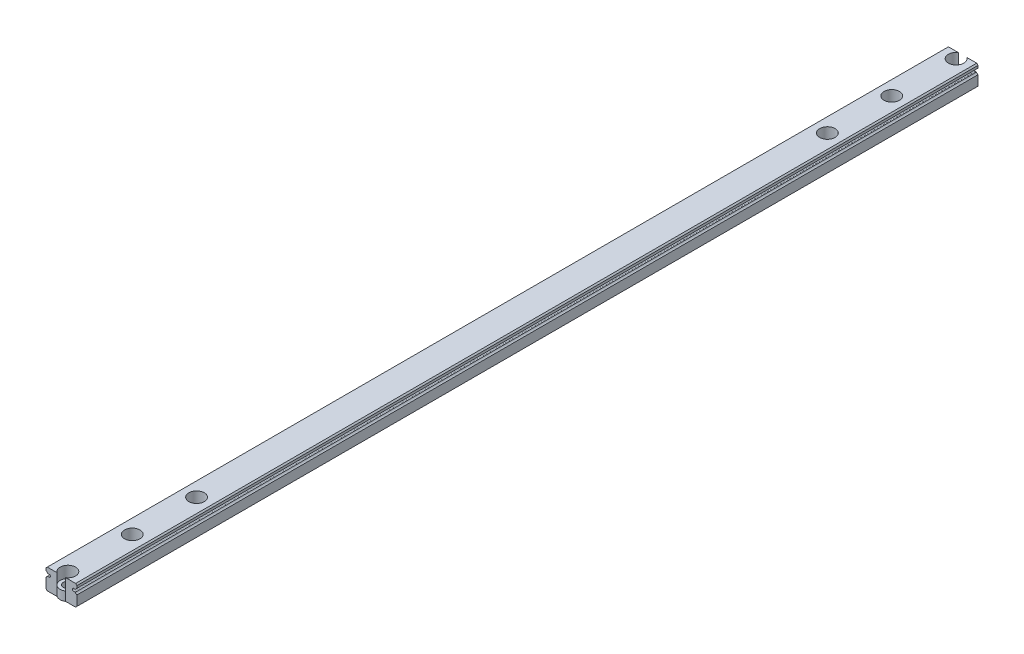
from build123d import *

# Parameters (mm, degrees)
BOSS_EXTRUDE1_DEPTH     = 420
SKETCH2_R               = 3
CUT_EXTRUDE1_DEPTH      = 4.5
SKETCH3_R               = 1.75
CUT_EXTRUDE2_DEPTH      = 421.066958948
LPATTERN1_COUNT         = 4
LPATTERN1_PITCH         = 25
MIRROR1_COPY_1_SKETCH_R = 3
MIRROR1_COPY_1_DEPTH    = 4.5
MIRROR1_COPY_2_SKETCH_R = 3
MIRROR1_COPY_2_DEPTH    = 4.5
MIRROR1_COPY_3_SKETCH_R = 3
MIRROR1_COPY_3_DEPTH    = 4.5
MIRROR1_COPY_4_SKETCH_R = 1.75
MIRROR1_COPY_4_DEPTH    = 421.066958948
MIRROR1_COPY_5_SKETCH_R = 1.75
MIRROR1_COPY_5_DEPTH    = 421.066958948
MIRROR1_COPY_6_SKETCH_R = 1.75
MIRROR1_COPY_6_DEPTH    = 421.066958948
SKETCH5_R               = 3
SKETCH5_W               = 0.5
SKETCH5_H               = 35
CUT_EXTRUDE3_DEPTH      = 421.119030752


with BuildPart() as part:
    # Sketch1 → Boss-Extrude1 (new body)
    with BuildSketch(Plane.XY):
        with BuildLine():
            Line((6, -3.5), (6, 0.368911094))
            ThreePointArc((6, 0.368911094), (5.63354293, 0.61854293), (5.383911094, 0.985))
            Line((5.383911094, 0.985), (4.92112495, 0.985))
            ThreePointArc((4.92112495, 0.985), (4.265, 1.46), (4.92112495, 1.935))
            Line((4.92112495, 1.935), (5.383911094, 1.935))
            ThreePointArc((5.383911094, 1.935), (5.63354293, 2.30145707), (6, 2.551088906))
            Line((6, 2.551088906), (6, 3.5))
            Line((6, 3.5), (5.5, 4))
            Line((5.5, 4), (-5.5, 4))
            Line((-5.5, 4), (-6, 3.5))
            Line((-6, 3.5), (-6, 2.551088906))
            ThreePointArc((-6, 2.551088906), (-5.63354293, 2.30145707), (-5.383911094, 1.935))
            Line((-5.383911094, 1.935), (-4.92112495, 1.935))
            ThreePointArc((-4.92112495, 1.935), (-4.265, 1.46), (-4.92112495, 0.985))
            Line((-4.92112495, 0.985), (-5.383911094, 0.985))
            ThreePointArc((-5.383911094, 0.985), (-5.63354293, 0.61854293), (-6, 0.368911094))
            Line((-6, 0.368911094), (-6, -3.5))
            Line((-6, -3.5), (-5.5, -4))
            Line((-5.5, -4), (5.5, -4))
            Line((5.5, -4), (6, -3.5))
        make_face()
    extrude(amount=BOSS_EXTRUDE1_DEPTH)

    # Sketch2 → Cut-Extrude1 (cut)
    with BuildSketch(Plane(origin=(0, 4, 0), x_dir=(1, 0, 0), z_dir=(0, 1, 0))):
        with Locations(Location((0, -12.5, 0), (0, 0, 180))):
            Circle(SKETCH2_R)
    cut_extrude1 = extrude(amount=-CUT_EXTRUDE1_DEPTH, mode=Mode.SUBTRACT)

    # Sketch3 → Cut-Extrude2 (cut, through all)
    with BuildSketch(Plane(origin=(0, -0.5, 0), x_dir=(1, 0, 0), z_dir=(0, 1, 0))):
        with Locations(Location((0, -12.5, 0), (0, 0, 180))):
            Circle(SKETCH3_R)
    cut_extrude2 = extrude(amount=-CUT_EXTRUDE2_DEPTH, mode=Mode.SUBTRACT)

    # LPattern1: Cut-Extrude1, Cut-Extrude2 ×4
    with Locations(*[(0, 0, i * LPATTERN1_PITCH) for i in range(1, LPATTERN1_COUNT)]):
        add(cut_extrude1, mode=Mode.SUBTRACT)
        add(cut_extrude2, mode=Mode.SUBTRACT)

    # Mirror1: Cut-Extrude1, Cut-Extrude2 across plane
    add(cut_extrude1.mirror(Plane.XY.offset(210)), mode=Mode.SUBTRACT)
    add(cut_extrude2.mirror(Plane.XY.offset(210)), mode=Mode.SUBTRACT)

    # Mirror1 copy 1 sketch → Mirror1 copy 1 (cut)
    with BuildSketch(Plane(origin=(0, 4, 395), x_dir=(1, 0, 0), z_dir=(0, 1, 0))):
        with Locations((0, 12.5)):
            Circle(MIRROR1_COPY_1_SKETCH_R)
    extrude(amount=-MIRROR1_COPY_1_DEPTH, mode=Mode.SUBTRACT)

    # Mirror1 copy 2 sketch → Mirror1 copy 2 (cut)
    with BuildSketch(Plane(origin=(0, 4, 370), x_dir=(1, 0, 0), z_dir=(0, 1, 0))):
        with Locations((0, 12.5)):
            Circle(MIRROR1_COPY_2_SKETCH_R)
    extrude(amount=-MIRROR1_COPY_2_DEPTH, mode=Mode.SUBTRACT)

    # Mirror1 copy 3 sketch → Mirror1 copy 3 (cut)
    with BuildSketch(Plane(origin=(0, 4, 345), x_dir=(1, 0, 0), z_dir=(0, 1, 0))):
        with Locations((0, 12.5)):
            Circle(MIRROR1_COPY_3_SKETCH_R)
    extrude(amount=-MIRROR1_COPY_3_DEPTH, mode=Mode.SUBTRACT)

    # Mirror1 copy 4 sketch → Mirror1 copy 4 (cut, through all)
    with BuildSketch(Plane(origin=(0, -0.5, 395), x_dir=(1, 0, 0), z_dir=(0, 1, 0))):
        with Locations((0, 12.5)):
            Circle(MIRROR1_COPY_4_SKETCH_R)
    extrude(amount=-MIRROR1_COPY_4_DEPTH, mode=Mode.SUBTRACT)

    # Mirror1 copy 5 sketch → Mirror1 copy 5 (cut, through all)
    with BuildSketch(Plane(origin=(0, -0.5, 370), x_dir=(1, 0, 0), z_dir=(0, 1, 0))):
        with Locations((0, 12.5)):
            Circle(MIRROR1_COPY_5_SKETCH_R)
    extrude(amount=-MIRROR1_COPY_5_DEPTH, mode=Mode.SUBTRACT)

    # Mirror1 copy 6 sketch → Mirror1 copy 6 (cut, through all)
    with BuildSketch(Plane(origin=(0, -0.5, 345), x_dir=(1, 0, 0), z_dir=(0, 1, 0))):
        with Locations((0, 12.5)):
            Circle(MIRROR1_COPY_6_SKETCH_R)
    extrude(amount=-MIRROR1_COPY_6_DEPTH, mode=Mode.SUBTRACT)

    # Sketch5 → Cut-Extrude3 (cut, through all)
    # profile 1 of 8: a face of its own
    with BuildSketch(Plane(origin=(0, 4, 0), x_dir=(1, 0, 0), z_dir=(0, 1, 0))):
        with BuildLine():
            Line((-1.658312395, -385), (-5.5, -385))
            Line((-5.5, -385), (-5.5, -420))
            Line((-5.5, -420), (5.5, -420))
            Line((5.5, -420), (5.5, -385))
            Line((5.5, -385), (1.658312395, -385))
            ThreePointArc((1.658312395, -385), (0, -385.5), (-1.658312395, -385))
        make_face()
        with Locations((0, -407.5)):
            Circle(SKETCH5_R, mode=Mode.SUBTRACT)
    # profile 2 of 8: a face of its own
    with BuildSketch(Plane(origin=(0, 4, 0), x_dir=(1, 0, 0), z_dir=(0, 1, 0))):
        with Locations((-5.75, -402.5)):
            Rectangle(SKETCH5_W, SKETCH5_H)
    # profile 3 of 8: a face of its own
    with BuildSketch(Plane(origin=(0, 4, 0), x_dir=(1, 0, 0), z_dir=(0, 1, 0))):
        with Locations((5.75, -402.5)):
            Rectangle(SKETCH5_W, SKETCH5_H)
    # profile 4 of 8: a face of its own
    with BuildSketch(Plane(origin=(0, 4, 0), x_dir=(1, 0, 0), z_dir=(0, 1, 0))):
        with Locations((0, -407.5)):
            Circle(SKETCH5_R)
    # profile 5 of 8: a face of its own
    with BuildSketch(Plane(origin=(0, 4, 0), x_dir=(1, 0, 0), z_dir=(0, 1, 0))):
        with BuildLine():
            Line((-5.5, 0), (-5.5, -35))
            Line((-5.5, -35), (-1.658312395, -35))
            ThreePointArc((-1.658312395, -35), (0, -34.5), (1.658312395, -35))
            Line((1.658312395, -35), (5.5, -35))
            Line((5.5, -35), (5.5, 0))
            Line((5.5, 0), (-5.5, 0))
        make_face()
        with Locations((0, -12.5)):
            Circle(SKETCH5_R, mode=Mode.SUBTRACT)
    # profile 6 of 8: a face of its own
    with BuildSketch(Plane(origin=(0, 4, 0), x_dir=(1, 0, 0), z_dir=(0, 1, 0))):
        with Locations((0, -12.5)):
            Circle(SKETCH5_R)
    # profile 7 of 8: a face of its own
    with BuildSketch(Plane(origin=(0, 4, 0), x_dir=(1, 0, 0), z_dir=(0, 1, 0))):
        with Locations((5.75, -17.5)):
            Rectangle(SKETCH5_W, SKETCH5_H)
    # profile 8 of 8: a face of its own
    with BuildSketch(Plane(origin=(0, 4, 0), x_dir=(1, 0, 0), z_dir=(0, 1, 0))):
        with Locations((-5.75, -17.5)):
            Rectangle(SKETCH5_W, SKETCH5_H)
    extrude(amount=-CUT_EXTRUDE3_DEPTH, mode=Mode.SUBTRACT)


solid = part.part
